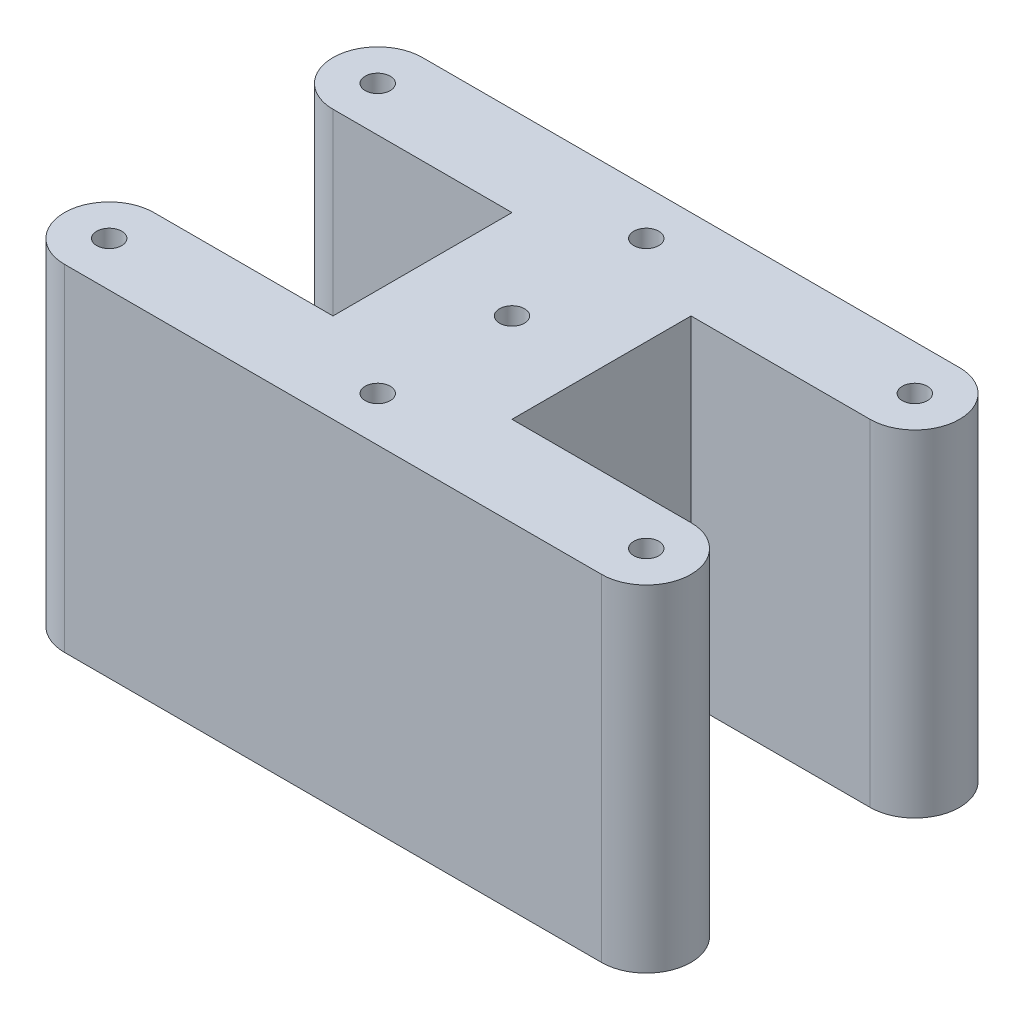
from build123d import *

# Parameters (mm, degrees)
SKETCH_1_R      = 1.4
EXTRUDE_1_DEPTH = 37.55


with BuildPart() as part:
    # 草图1 → 凸台-拉伸1 (new body)
    with BuildSketch(Plane(origin=(0, 0, 0), x_dir=(1, 0, 0), z_dir=(0, 1, 0))):
        with BuildLine():
            Line((4.448985647, -10.849582747), (4.448985647, 9.150417253))
            Line((4.448985647, 9.150417253), (24.448985647, 9.150417253))
            ThreePointArc((24.448985647, 9.150417253), (29.448985647, 14.150417253), (24.448985647, 19.150417253))
            Line((24.448985647, 19.150417253), (-35.551014353, 19.150417253))
            ThreePointArc((-35.551014353, 19.150417253), (-40.551014353, 14.150417253), (-35.551014353, 9.150417253))
            Line((-35.551014353, 9.150417253), (-15.551014353, 9.150417253))
            Line((-15.551014353, 9.150417253), (-15.551014353, -10.849582747))
            Line((-15.551014353, -10.849582747), (-35.551014353, -10.849582747))
            ThreePointArc((-35.551014353, -10.849582747), (-40.551014353, -15.849582747), (-35.551014353, -20.849582747))
            Line((-35.551014353, -20.849582747), (24.448985647, -20.849582747))
            ThreePointArc((24.448985647, -20.849582747), (29.448985647, -15.849582747), (24.448985647, -10.849582747))
            Line((24.448985647, -10.849582747), (4.448985647, -10.849582747))
        make_face()
        with Locations(Location((24.448985647, 14.150417253, 0), (0, 0, 270))):
            Circle(SKETCH_1_R, mode=Mode.SUBTRACT)
        with Locations(Location((24.448985647, -15.849582747, 0), (0, 0, 90))):
            Circle(SKETCH_1_R, mode=Mode.SUBTRACT)
        with Locations(Location((-5.551014353, 14.150417253, 0), (0, 0, 270))):
            Circle(SKETCH_1_R, mode=Mode.SUBTRACT)
        with Locations(Location((-5.551014353, -0.849582747, 0), (0, 0, 270))):
            Circle(SKETCH_1_R, mode=Mode.SUBTRACT)
        with Locations(Location((-5.551014353, -15.849582747, 0), (0, 0, 90))):
            Circle(SKETCH_1_R, mode=Mode.SUBTRACT)
        with Locations(Location((-35.551014353, -15.849582747, 0), (0, 0, 270))):
            Circle(SKETCH_1_R, mode=Mode.SUBTRACT)
        with Locations(Location((-35.551014353, 14.150417253, 0), (0, 0, 90))):
            Circle(SKETCH_1_R, mode=Mode.SUBTRACT)
    extrude(amount=EXTRUDE_1_DEPTH)


solid = part.part
